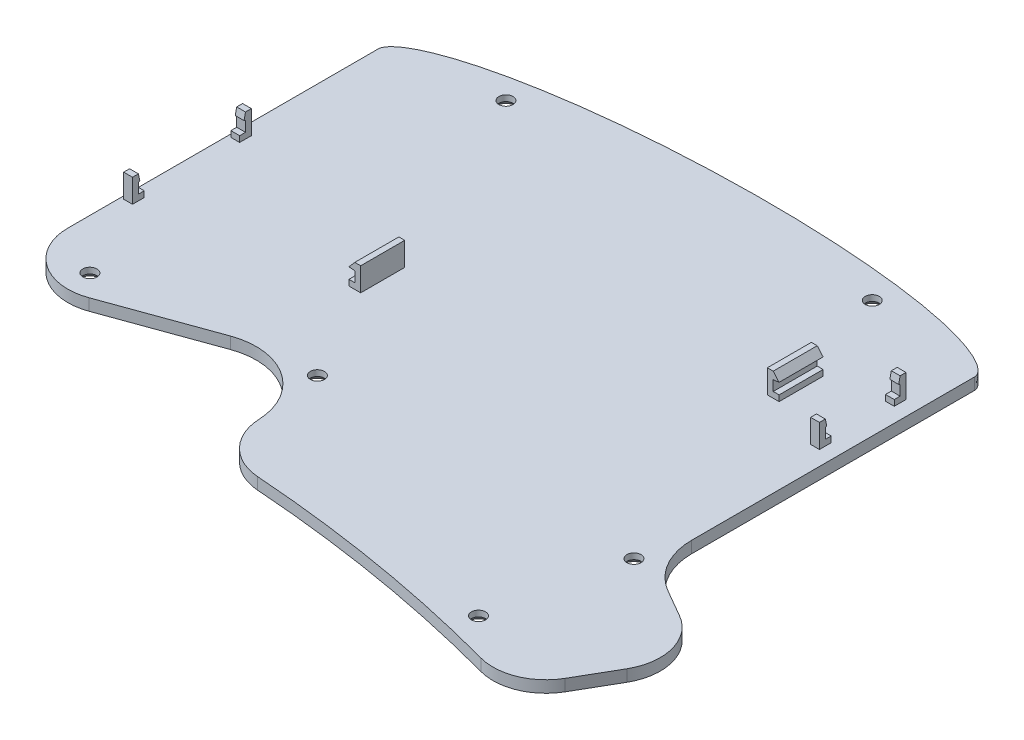
from build123d import *

# Parameters (mm, degrees)
SKETCH1_W                                      = 1
SKETCH1_H                                      = 13
SKETCH1_H_2                                    = 21
BOSS_EXTRUDE1_DEPTH                            = 2
CSK_FOR_M2_FLAT_HEAD_MACHINE_SCREW2_AT_2_COUNT = 2
CSK_FOR_M2_FLAT_HEAD_MACHINE_SCREW2_AT_2_PITCH = 60.71715783
CSK_FOR_M2_FLAT_HEAD_MACHINE_SCREW2_AT_3_COUNT = 2
CSK_FOR_M2_FLAT_HEAD_MACHINE_SCREW2_AT_3_PITCH = 94.415886592
CSK_FOR_M2_FLAT_HEAD_MACHINE_SCREW2_AT_4_COUNT = 2
CSK_FOR_M2_FLAT_HEAD_MACHINE_SCREW2_AT_4_PITCH = 68.646308598
CSK_FOR_M2_FLAT_HEAD_MACHINE_SCREW2_AT_5_COUNT = 2
CSK_FOR_M2_FLAT_HEAD_MACHINE_SCREW2_AT_5_PITCH = 81.128678366
CSK_FOR_M2_FLAT_HEAD_MACHINE_SCREW2_AT_6_COUNT = 2
CSK_FOR_M2_FLAT_HEAD_MACHINE_SCREW2_AT_6_PITCH = 61.04624463
SKETCH8_W                                      = 1.5
SKETCH8_H                                      = 1
SKETCH8_W_2                                    = 1
SKETCH8_H_2                                    = 7.5
BOSS_EXTRUDE2_DEPTH                            = 1
BOSS_EXTRUDE3_START                            = 1
SKETCH8_3_W                                    = 1
SKETCH8_3_H                                    = 7.5
SKETCH8_3_W_2                                  = 1.5
SKETCH8_3_H_2                                  = 1
BOSS_EXTRUDE3_DEPTH                            = 3
BOSS_EXTRUDE4_REACH                            = 140.28
BOSS_EXTRUDE4_DIRECTION_2_REACH                = 140.28
BOSS_EXTRUDE5_REACH                            = 116.126
BOSS_EXTRUDE5_DIRECTION_2_REACH                = 116.126
BOSS_EXTRUDE6_REACH                            = 125.601
BOSS_EXTRUDE6_DIRECTION_2_REACH                = 125.601
BOSS_EXTRUDE7_REACH                            = 127.102
BOSS_EXTRUDE7_DIRECTION_2_REACH                = 127.102


with BuildPart() as part:
    # Sketch1 → Boss-Extrude1 (new body)
    with BuildSketch(Plane(origin=(0, -18, 0), x_dir=(-1, 0, 0), z_dir=(0, -1, 0))):
        with BuildLine():
            Line((3.5375, 21.383174783), (3.5375, 46.51875))
            Line((3.5375, 46.51875), (2.5375, 46.51875))
            Line((2.5375, 46.51875), (2.5375, 21.383174783))
            ThreePointArc((2.5375, 21.383174783), (1.063470667, 15.882640004), (-2.96356961, 11.856277882))
            Line((-2.96356961, 11.856277882), (-7.606020535, 9.176652528))
            ThreePointArc((-7.606020535, 9.176652528), (-11.799966519, 3.712266146), (-10.901629499, -3.117206165))
            Line((-10.901629499, -3.117206165), (-7.061364098, -9.770465972))
            ThreePointArc((-7.061364098, -9.770465972), (-2.702134101, -13.589833364), (3.081788876, -13.959547339))
            ThreePointArc((3.081788876, -13.959547339), (25.794866758, -8.981326054), (48.881783112, -6.213495259))
            ThreePointArc((48.881783112, -6.213495259), (54.690504824, -3.515001844), (57.233571455, 2.36342709))
            ThreePointArc((57.233571455, 2.36342709), (62.105951354, 11.016634667), (71.9636238, 12.218458781))
            Line((71.9636238, 12.218458781), (89.669845612, 5.815157515))
            ThreePointArc((89.669845612, 5.815157515), (97.900386631, 6.911655641), (101.730615166, 14.278708172))
            Line((101.730615166, 14.278708172), (101.730615166, 22.93125))
            Line((101.730615166, 22.93125), (100.730615166, 22.93125))
            Line((100.730615166, 22.93125), (100.730615166, 14.278708172))
            ThreePointArc((100.730615166, 14.278708172), (100.419869855, 12.070685907), (99.511774585, 10.034196784))
            ThreePointArc((99.511774585, 10.034196784), (97.789489945, 9.2290678), (96.349172684, 10.470028415))
            ThreePointArc((96.349172684, 10.470028415), (92.672630426, 12.756839452), (89.986407023, 9.361155204))
            ThreePointArc((89.986407023, 9.361155204), (89.287071474, 7.854887539), (87.644376079, 7.611034457))
            Line((87.644376079, 7.611034457), (72.303709306, 13.158853298))
            ThreePointArc((72.303709306, 13.158853298), (68.259020854, 13.87406407), (64.210075088, 13.183362028))
            ThreePointArc((64.210075088, 13.183362028), (62.767655957, 13.306970242), (61.911902302, 14.474676378))
            ThreePointArc((61.911902302, 14.474676378), (56.707715414, 16.353605132), (57.366621578, 10.859992742))
            ThreePointArc((57.366621578, 10.859992742), (58.311661559, 9.763292521), (58.10732055, 8.330080502))
            ThreePointArc((58.10732055, 8.330080502), (56.781134603, 5.492262939), (56.234561293, 2.407909635))
            ThreePointArc((56.234561293, 2.407909635), (53.974057621, -2.817360528), (48.810749433, -5.216021341))
            ThreePointArc((48.810749433, -5.216021341), (31.764578857, -7.038247949), (14.890028494, -10.061820531))
            ThreePointArc((14.890028494, -10.061820531), (13.366465777, -9.66672828), (12.776518018, -8.207515177))
            ThreePointArc((12.776518018, -8.207515177), (8.78963294, -4.777782449), (6.761066998, -9.629920064))
            ThreePointArc((6.761066998, -9.629920064), (6.88714243, -11.19881975), (5.701883027, -12.234436179))
            ThreePointArc((5.701883027, -12.234436179), (4.260199796, -12.609882906), (2.820853415, -12.994191091))
            ThreePointArc((2.820853415, -12.994191091), (-2.320411453, -12.665556447), (-6.195282561, -9.27056321))
            Line((-6.195282561, -9.27056321), (-10.035547962, -2.617303402))
            ThreePointArc((-10.035547962, -2.617303402), (-10.834069758, 3.453338652), (-7.106117772, 8.310570991))
            Line((-7.106117772, 8.310570991), (-2.463666847, 10.990196345))
            ThreePointArc((-2.463666847, 10.990196345), (-1.495506776, 11.61275998), (-0.591448819, 12.325219533))
            ThreePointArc((-0.591448819, 12.325219533), (0.796234375, 12.73775716), (2.019793328, 11.963964275))
            ThreePointArc((2.019793328, 11.963964275), (7.550614754, 12.118718195), (4.928015057, 16.990669062))
            ThreePointArc((4.928015057, 16.990669062), (3.647327745, 17.665718652), (3.31329644, 19.074361625))
            ThreePointArc((3.31329644, 19.074361625), (3.481317591, 20.223338002), (3.5375, 21.383174783))
        make_face()
        with BuildLine():
            Line((3.5375, 59.51875), (3.5375, 46.51875))
            Line((3.5375, 46.51875), (3.5375, 21.383174783))
            ThreePointArc((3.5375, 21.383174783), (3.481317591, 20.223338002), (3.31329644, 19.074361625))
            ThreePointArc((3.31329644, 19.074361625), (3.647327745, 17.665718652), (4.928015057, 16.990669062))
            ThreePointArc((4.928015057, 16.990669062), (7.550614754, 12.118718195), (2.019793328, 11.963964275))
            ThreePointArc((2.019793328, 11.963964275), (0.796234375, 12.73775716), (-0.591448819, 12.325219533))
            ThreePointArc((-0.591448819, 12.325219533), (-1.495506776, 11.61275998), (-2.463666847, 10.990196345))
            Line((-2.463666847, 10.990196345), (-7.106117772, 8.310570991))
            ThreePointArc((-7.106117772, 8.310570991), (-10.834069758, 3.453338652), (-10.035547962, -2.617303402))
            Line((-10.035547962, -2.617303402), (-6.195282561, -9.27056321))
            ThreePointArc((-6.195282561, -9.27056321), (-2.320411453, -12.665556447), (2.820853415, -12.994191091))
            ThreePointArc((2.820853415, -12.994191091), (4.260199796, -12.609882906), (5.701883027, -12.234436179))
            ThreePointArc((5.701883027, -12.234436179), (6.88714243, -11.19881975), (6.761066998, -9.629920064))
            ThreePointArc((6.761066998, -9.629920064), (8.78963294, -4.777782449), (12.776518018, -8.207515177))
            ThreePointArc((12.776518018, -8.207515177), (13.366465777, -9.66672828), (14.890028494, -10.061820531))
            ThreePointArc((14.890028494, -10.061820531), (31.764578857, -7.038247949), (48.810749433, -5.216021341))
            ThreePointArc((48.810749433, -5.216021341), (53.974057621, -2.817360528), (56.234561293, 2.407909635))
            ThreePointArc((56.234561293, 2.407909635), (56.781134603, 5.492262939), (58.10732055, 8.330080502))
            ThreePointArc((58.10732055, 8.330080502), (58.311661559, 9.763292521), (57.366621578, 10.859992742))
            ThreePointArc((57.366621578, 10.859992742), (56.707715414, 16.353605132), (61.911902302, 14.474676378))
            ThreePointArc((61.911902302, 14.474676378), (62.767655957, 13.306970242), (64.210075088, 13.183362028))
            ThreePointArc((64.210075088, 13.183362028), (68.259020854, 13.87406407), (72.303709306, 13.158853298))
            Line((72.303709306, 13.158853298), (87.644376079, 7.611034457))
            ThreePointArc((87.644376079, 7.611034457), (89.287071474, 7.854887539), (89.986407023, 9.361155204))
            ThreePointArc((89.986407023, 9.361155204), (92.672630426, 12.756839452), (96.349172684, 10.470028415))
            ThreePointArc((96.349172684, 10.470028415), (97.789489945, 9.2290678), (99.511774585, 10.034196784))
            ThreePointArc((99.511774585, 10.034196784), (100.419869855, 12.070685907), (100.730615166, 14.278708172))
            Line((100.730615166, 14.278708172), (100.730615166, 22.93125))
            Line((100.730615166, 22.93125), (100.730615166, 43.93125))
            Line((100.730615166, 43.93125), (100.730615166, 67.164634727))
            add(Edge.make_bspline(
                [(88.620104248, 72.598317081), (88.929301473, 72.523560812), (89.238079904, 72.447060307), (90.562566461, 72.110499889), (91.57329427, 71.832096728), (93.57938348, 71.218232259), (94.573305027, 70.883949605), (96.040749334, 70.31553203), (96.525188662, 70.115027036), (97.480793406, 69.682916814), (97.952079847, 69.451604933), (98.868980609, 68.942188708), (99.31665083, 68.665028512), (99.939326788, 68.184144678), (100.139184116, 68.012869641), (100.410015865, 67.727114834), (100.495516055, 67.627114913), (100.608228775, 67.465419655), (100.643137924, 67.409749415), (100.687729415, 67.321804673), (100.701248617, 67.291904033), (100.723269859, 67.229917254), (100.73418758, 67.197643884), (100.730615166, 67.164634727)],
                knots=[0.865518224, 0.865518224, 0.865518224, 0.865518224, 0.875, 0.875, 0.90625, 0.90625, 0.9375, 0.9375, 0.953125, 0.953125, 0.96875, 0.96875, 0.984375, 0.984375, 0.9921875, 0.9921875, 0.99609375, 0.99609375, 0.998046875, 0.998046875, 0.999023438, 0.999023438, 1, 1, 1, 1], degree=3))
            ThreePointArc((88.620104248, 72.598317081), (87.063552302, 72.220505208), (86.466465706, 70.734206662))
            ThreePointArc((86.466465706, 70.734206662), (82.615217481, 67.240064482), (80.339453892, 71.9157508))
            ThreePointArc((80.339453892, 71.9157508), (80.341311658, 73.510795049), (79.048332963, 74.444805595))
            add(Edge.make_bspline(
                [(26.948050585, 75.898504354), (27.111227376, 75.913938633), (27.274398145, 75.929121002), (31.596167021, 76.324738014), (35.751054647, 76.549982719), (44.055510634, 76.777995247), (52.354550241, 76.779469056), (60.643745607, 76.369209951), (68.927521195, 75.732270067), (73.066747928, 75.302501914), (77.817537532, 74.629953207), (78.432988847, 74.539313014), (79.048332963, 74.444805595)],
                knots=[0.245095563, 0.245095563, 0.245095563, 0.245095563, 0.25, 0.25, 0.375, 0.375, 0.5, 0.625, 0.625, 0.75, 0.75, 0.76859764, 0.76859764, 0.76859764, 0.76859764], degree=3))
            ThreePointArc((26.948050585, 75.898504354), (25.603535559, 75.041998878), (25.51147164, 73.450506961))
            ThreePointArc((25.51147164, 73.450506961), (22.957426833, 68.917027953), (19.326954928, 72.644661323))
            ThreePointArc((19.326954928, 72.644661323), (18.825675188, 74.163836813), (17.298656749, 74.64069133))
            add(Edge.make_bspline(
                [(3.5375, 69.572252231), (3.541173709, 69.606197357), (3.554301601, 69.637518494), (3.581974976, 69.69884299), (3.59790109, 69.728184635), (3.649208348, 69.813979148), (3.688170843, 69.868168455), (3.813161744, 70.025614685), (3.90522549, 70.121181493), (4.194279123, 70.393030468), (4.405585706, 70.554931133), (5.061372746, 71.006569742), (5.522514638, 71.25902), (6.466097746, 71.720662819), (6.949517754, 71.92786751), (7.931027893, 72.312482719), (8.428830807, 72.489345777), (9.926006799, 72.983364256), (10.934004841, 73.266597108), (12.96190189, 73.777521594), (13.981961729, 74.004462636), (15.768195991, 74.364895691), (16.532403117, 74.507568977), (17.298656749, 74.64069133)],
                knots=[0, 0, 0, 0, 0.000976562, 0.000976562, 0.001953125, 0.001953125, 0.00390625, 0.00390625, 0.0078125, 0.0078125, 0.015625, 0.015625, 0.03125, 0.03125, 0.046875, 0.046875, 0.0625, 0.0625, 0.09375, 0.09375, 0.125, 0.125, 0.148240494, 0.148240494, 0.148240494, 0.148240494], degree=3))
            Line((3.5375, 69.572252231), (3.5375, 59.51875))
        make_face()
        with Locations((3.0375, 53.01875)):
            Rectangle(SKETCH1_W, SKETCH1_H)
        with BuildLine():
            Line((2.5375, 59.51875), (3.5375, 59.51875))
            Line((3.5375, 59.51875), (3.5375, 69.572252231))
            add(Edge.make_bspline(
                [(3.5375, 69.572252231), (3.541173709, 69.606197357), (3.554301601, 69.637518494), (3.581974976, 69.69884299), (3.59790109, 69.728184635), (3.649208348, 69.813979148), (3.688170843, 69.868168455), (3.813161744, 70.025614685), (3.90522549, 70.121181493), (4.194279123, 70.393030468), (4.405585706, 70.554931133), (5.061372746, 71.006569742), (5.522514638, 71.25902), (6.466097746, 71.720662819), (6.949517754, 71.92786751), (7.931027893, 72.312482719), (8.428830807, 72.489345777), (9.926006799, 72.983364256), (10.934004841, 73.266597108), (12.96190189, 73.777521594), (13.981961729, 74.004462636), (15.768195991, 74.364895691), (16.532403117, 74.507568977), (17.298656749, 74.64069133)],
                knots=[0, 0, 0, 0, 0.000976562, 0.000976562, 0.001953125, 0.001953125, 0.00390625, 0.00390625, 0.0078125, 0.0078125, 0.015625, 0.015625, 0.03125, 0.03125, 0.046875, 0.046875, 0.0625, 0.0625, 0.09375, 0.09375, 0.125, 0.125, 0.148240494, 0.148240494, 0.148240494, 0.148240494], degree=3))
            ThreePointArc((17.298656749, 74.64069133), (18.825675188, 74.163836813), (19.326954928, 72.644661323))
            ThreePointArc((19.326954928, 72.644661323), (22.957426833, 68.917027953), (25.51147164, 73.450506961))
            ThreePointArc((25.51147164, 73.450506961), (25.603535559, 75.041998878), (26.948050585, 75.898504354))
            add(Edge.make_bspline(
                [(26.948050585, 75.898504354), (27.111227376, 75.913938633), (27.274398145, 75.929121002), (31.596167021, 76.324738014), (35.751054647, 76.549982719), (44.055510634, 76.777995247), (52.354550241, 76.779469056), (60.643745607, 76.369209951), (68.927521195, 75.732270067), (73.066747928, 75.302501914), (77.817537532, 74.629953207), (78.432988847, 74.539313014), (79.048332963, 74.444805595)],
                knots=[0.245095563, 0.245095563, 0.245095563, 0.245095563, 0.25, 0.25, 0.375, 0.375, 0.5, 0.625, 0.625, 0.75, 0.75, 0.76859764, 0.76859764, 0.76859764, 0.76859764], degree=3))
            ThreePointArc((79.048332963, 74.444805595), (80.341311658, 73.510795049), (80.339453892, 71.9157508))
            ThreePointArc((80.339453892, 71.9157508), (82.615217481, 67.240064482), (86.466465706, 70.734206662))
            ThreePointArc((86.466465706, 70.734206662), (87.063552302, 72.220505208), (88.620104248, 72.598317081))
            add(Edge.make_bspline(
                [(88.620104248, 72.598317081), (88.929301473, 72.523560812), (89.238079904, 72.447060307), (90.562566461, 72.110499889), (91.57329427, 71.832096728), (93.57938348, 71.218232259), (94.573305027, 70.883949605), (96.040749334, 70.31553203), (96.525188662, 70.115027036), (97.480793406, 69.682916814), (97.952079847, 69.451604933), (98.868980609, 68.942188708), (99.31665083, 68.665028512), (99.939326788, 68.184144678), (100.139184116, 68.012869641), (100.410015865, 67.727114834), (100.495516055, 67.627114913), (100.608228775, 67.465419655), (100.643137924, 67.409749415), (100.687729415, 67.321804673), (100.701248617, 67.291904033), (100.723269859, 67.229917254), (100.73418758, 67.197643884), (100.730615166, 67.164634727)],
                knots=[0.865518224, 0.865518224, 0.865518224, 0.865518224, 0.875, 0.875, 0.90625, 0.90625, 0.9375, 0.9375, 0.953125, 0.953125, 0.96875, 0.96875, 0.984375, 0.984375, 0.9921875, 0.9921875, 0.99609375, 0.99609375, 0.998046875, 0.998046875, 0.999023438, 0.999023438, 1, 1, 1, 1], degree=3))
            Line((100.730615166, 67.164634727), (100.730615166, 43.93125))
            Line((100.730615166, 43.93125), (101.730615166, 43.93125))
            Line((101.730615166, 43.93125), (101.730615166, 67.138668169))
            add(Edge.make_bspline(
                [(101.730615166, 67.138668169), (101.735250856, 67.275115571), (101.713390966, 67.410853841), (101.633067165, 67.668568345), (101.575943762, 67.790415694), (101.372266606, 68.142605821), (101.199050454, 68.35209953), (100.823600333, 68.73987033), (100.621626657, 68.91640552), (100.200752158, 69.248864107), (99.981555205, 69.4045279), (99.306020246, 69.849053581), (98.836934468, 70.112892412), (97.877227791, 70.60318759), (97.388248328, 70.828061244), (95.903014167, 71.461712841), (94.889908109, 71.8297132), (92.84420924, 72.500797549), (91.810189071, 72.803249694), (88.691987496, 73.64074601), (86.588446512, 74.108153002), (82.363129011, 74.930812273), (80.23840048, 75.28499058), (73.849740033, 76.220505361), (69.565842948, 76.677808339), (60.985265325, 77.35347005), (56.684044098, 77.570000099), (48.079283608, 77.782221024), (43.778248843, 77.778001783), (37.328917876, 77.5895358), (35.179515146, 77.496024517), (30.881566022, 77.238782186), (28.735526018, 77.075301003), (24.458229251, 76.663778997), (22.325886522, 76.416107346), (18.078385438, 75.806547795), (15.962972556, 75.446351614), (12.810643947, 74.767871486), (11.76337701, 74.518387043), (9.679226408, 73.950405555), (8.640851682, 73.63218254), (7.121659224, 73.074949932), (6.620981384, 72.875527364), (5.636459764, 72.436424079), (5.152330354, 72.197426437), (4.447748092, 71.787245869), (4.215675375, 71.641076345), (3.770440702, 71.328087125), (3.556445051, 71.161234247), (3.256558964, 70.885596087), (3.160158936, 70.789437239), (2.977470232, 70.584971563), (2.891265175, 70.476633482), (2.663759238, 70.135173542), (2.546954708, 69.876509698), (2.5375, 69.598218788)],
                knots=[0, 0, 0, 0, 0.00390625, 0.00390625, 0.0078125, 0.0078125, 0.015625, 0.015625, 0.0234375, 0.0234375, 0.03125, 0.03125, 0.046875, 0.046875, 0.0625, 0.0625, 0.09375, 0.09375, 0.125, 0.125, 0.1875, 0.1875, 0.25, 0.25, 0.375, 0.375, 0.5, 0.5, 0.625, 0.625, 0.6875, 0.6875, 0.75, 0.75, 0.8125, 0.8125, 0.875, 0.875, 0.90625, 0.90625, 0.9375, 0.9375, 0.953125, 0.953125, 0.96875, 0.96875, 0.9765625, 0.9765625, 0.984375, 0.984375, 0.98828125, 0.98828125, 0.9921875, 0.9921875, 1, 1, 1, 1], degree=3))
            Line((2.5375, 69.598218788), (2.5375, 59.51875))
        make_face()
        with Locations((101.230615166, 33.43125)):
            Rectangle(SKETCH1_W, SKETCH1_H_2)
    extrude(amount=BOSS_EXTRUDE1_DEPTH)

    # Sketch7 → CSK for M2 Flat Head Machine Screw2 (revolve, cut)
    with BuildSketch(Plane(origin=(-22.5375, -20, -72.139784762), x_dir=(0, 0, -1), z_dir=(1, 0, 0))):
        Polygon((0, 0), (0, 2), (1.2, 2), (1.2, 1), (2.2, 0), align=None)
    csk_for_m2_flat_head_machine_screw2 = revolve(axis=Axis((-22.5375, -26.35, -72.139784762), (0, 1, 0)), mode=Mode.SUBTRACT)

    # CSK for M2 Flat Head Machine Screw2 at 2: CSK for M2 Flat Head Machine Screw2 ×2
    with Locations(*[Vector(-0.9996040219096323, 0, 0.02813893000964052) * (i * CSK_FOR_M2_FLAT_HEAD_MACHINE_SCREW2_AT_2_PITCH) for i in range(1, CSK_FOR_M2_FLAT_HEAD_MACHINE_SCREW2_AT_2_COUNT)]):
        add(csk_for_m2_flat_head_machine_screw2, mode=Mode.SUBTRACT)

    # CSK for M2 Flat Head Machine Screw2 at 3: CSK for M2 Flat Head Machine Screw2 ×2
    with Locations(*[Vector(-0.7487417395271838, 0, 0.6628618313719737) * (i * CSK_FOR_M2_FLAT_HEAD_MACHINE_SCREW2_AT_3_PITCH) for i in range(1, CSK_FOR_M2_FLAT_HEAD_MACHINE_SCREW2_AT_3_COUNT)]):
        add(csk_for_m2_flat_head_machine_screw2, mode=Mode.SUBTRACT)

    # CSK for M2 Flat Head Machine Screw2 at 4: CSK for M2 Flat Head Machine Screw2 ×2
    with Locations(*[Vector(-0.5272405159888823, 0, 0.8497160927626222) * (i * CSK_FOR_M2_FLAT_HEAD_MACHINE_SCREW2_AT_4_PITCH) for i in range(1, CSK_FOR_M2_FLAT_HEAD_MACHINE_SCREW2_AT_4_COUNT)]):
        add(csk_for_m2_flat_head_machine_screw2, mode=Mode.SUBTRACT)

    # CSK for M2 Flat Head Machine Screw2 at 5: CSK for M2 Flat Head Machine Screw2 ×2
    with Locations(*[Vector(0.16023926756585227, 0, 0.987078202134947) * (i * CSK_FOR_M2_FLAT_HEAD_MACHINE_SCREW2_AT_5_PITCH) for i in range(1, CSK_FOR_M2_FLAT_HEAD_MACHINE_SCREW2_AT_5_COUNT)]):
        add(csk_for_m2_flat_head_machine_screw2, mode=Mode.SUBTRACT)

    # CSK for M2 Flat Head Machine Screw2 at 6: CSK for M2 Flat Head Machine Screw2 ×2
    with Locations(*[Vector(0.2915822276671845, 0, 0.9565457670747607) * (i * CSK_FOR_M2_FLAT_HEAD_MACHINE_SCREW2_AT_6_PITCH) for i in range(1, CSK_FOR_M2_FLAT_HEAD_MACHINE_SCREW2_AT_6_COUNT)]):
        add(csk_for_m2_flat_head_machine_screw2, mode=Mode.SUBTRACT)

    # Sketch8 → Boss-Extrude2 (add)
    with BuildSketch(Plane(origin=(0, -18, 0), x_dir=(1, 0, 0), z_dir=(0, 1, 0))):
        with Locations((-5.7875, 47.14375)):
            Rectangle(SKETCH8_W, SKETCH8_H)
        with Locations((-5.7875, 58.89375)):
            Rectangle(SKETCH8_W, SKETCH8_H)
        with Locations((-5.7875, 59.89375)):
            Rectangle(SKETCH8_W, SKETCH8_H)
        with Locations((-16.0375, 53.01875)):
            Rectangle(SKETCH8_W_2, SKETCH8_H_2)
        with Locations((-17.0375, 53.01875)):
            Rectangle(SKETCH8_W_2, SKETCH8_H_2)
        with Locations((-5.7875, 46.14375)):
            Rectangle(SKETCH8_W, SKETCH8_H)
        with Locations((-68.730615166, 33.43125)):
            Rectangle(SKETCH8_W_2, SKETCH8_H_2)
        with Locations((-67.730615166, 33.43125)):
            Rectangle(SKETCH8_W_2, SKETCH8_H_2)
        with Locations((-100.480615166, 23.80625)):
            Rectangle(SKETCH8_W, SKETCH8_H)
        with Locations((-100.480615166, 24.80625)):
            Rectangle(SKETCH8_W, SKETCH8_H)
        with Locations((-100.480615166, 42.05625)):
            Rectangle(SKETCH8_W, SKETCH8_H)
        with Locations((-100.480615166, 43.05625)):
            Rectangle(SKETCH8_W, SKETCH8_H)
    extrude(amount=BOSS_EXTRUDE2_DEPTH)

    # Sketch8<3> → Boss-Extrude3 (add)
    with BuildSketch(Plane(origin=(0, -18, 0), x_dir=(1, 0, 0), z_dir=(0, 1, 0)).offset(BOSS_EXTRUDE3_START)):
        with Locations((-17.0375, 53.01875)):
            Rectangle(SKETCH8_3_W, SKETCH8_3_H)
        with Locations((-5.7875, 46.14375)):
            Rectangle(SKETCH8_3_W_2, SKETCH8_3_H_2)
        with Locations((-5.7875, 59.89375)):
            Rectangle(SKETCH8_3_W_2, SKETCH8_3_H_2)
        with Locations((-67.730615166, 33.43125)):
            Rectangle(SKETCH8_3_W, SKETCH8_3_H)
        with Locations((-100.480615166, 23.80625)):
            Rectangle(SKETCH8_3_W_2, SKETCH8_3_H_2)
        with Locations((-100.480615166, 43.05625)):
            Rectangle(SKETCH8_3_W_2, SKETCH8_3_H_2)
    extrude(amount=BOSS_EXTRUDE3_DEPTH)

    # Boss-Extrude4: up to this face of the body (flat: up to its plane)
    boss_extrude4_end = Plane(part.part.faces().sort_by_distance((-101.230615166, -16.3, -42.85625))[0])
    # Sketch12 → Boss-Extrude4 (add, up to the picked face)
    with BuildSketch(Plane.ZY.offset(100.480615166), mode=Mode.PRIVATE) as boss_extrude4_sk1:
        Polygon((-24.55625, -15.15), (-24.30625, -15.25), (-24.30625, -14), align=None)
    boss_extrude4_tool1 = split(extrude(boss_extrude4_sk1.sketch, amount=BOSS_EXTRUDE4_REACH, mode=Mode.PRIVATE), bisect_by=boss_extrude4_end, keep=Keep.BOTH, mode=Mode.PRIVATE)
    # Sketch12 → Boss-Extrude4 (add, up to the picked face)
    with BuildSketch(Plane.ZY.offset(100.480615166), mode=Mode.PRIVATE) as boss_extrude4_sk2:
        Polygon((-42.30625, -15.15), (-42.55625, -15.25), (-42.55625, -14), align=None)
    boss_extrude4_tool2 = split(extrude(boss_extrude4_sk2.sketch, amount=BOSS_EXTRUDE4_REACH, mode=Mode.PRIVATE), bisect_by=boss_extrude4_end, keep=Keep.BOTH, mode=Mode.PRIVATE)
    add(boss_extrude4_tool1.solids().sort_by(Axis((-100.480615, -14.8, -24.389583), (-1, 0, 0)))[0])
    add(boss_extrude4_tool2.solids().sort_by(Axis((-100.480615, -14.8, -42.472917), (-1, 0, 0)))[0])

    # Boss-Extrude4 direction 2: up to this face of the body (flat: up to its plane)
    boss_extrude4_direction_2_end = Plane(part.part.faces().sort_by_distance((-99.730615166, -16.3, -42.85625))[0])
    # Sketch12 → Boss-Extrude4 direction 2 (add, up to the picked face)
    with BuildSketch(Plane.ZY.offset(100.480615166), mode=Mode.PRIVATE) as boss_extrude4_direction_2_sk1:
        Polygon((-24.55625, -15.15), (-24.30625, -15.25), (-24.30625, -14), align=None)
    boss_extrude4_direction_2_tool1 = split(extrude(boss_extrude4_direction_2_sk1.sketch, amount=-BOSS_EXTRUDE4_DIRECTION_2_REACH, mode=Mode.PRIVATE), bisect_by=boss_extrude4_direction_2_end, keep=Keep.BOTH, mode=Mode.PRIVATE)
    # Sketch12 → Boss-Extrude4 direction 2 (add, up to the picked face)
    with BuildSketch(Plane.ZY.offset(100.480615166), mode=Mode.PRIVATE) as boss_extrude4_direction_2_sk2:
        Polygon((-42.30625, -15.15), (-42.55625, -15.25), (-42.55625, -14), align=None)
    boss_extrude4_direction_2_tool2 = split(extrude(boss_extrude4_direction_2_sk2.sketch, amount=-BOSS_EXTRUDE4_DIRECTION_2_REACH, mode=Mode.PRIVATE), bisect_by=boss_extrude4_direction_2_end, keep=Keep.BOTH, mode=Mode.PRIVATE)
    add(boss_extrude4_direction_2_tool1.solids().sort_by(Axis((-100.480615, -14.8, -24.389583), (1, 0, 0)))[0])
    add(boss_extrude4_direction_2_tool2.solids().sort_by(Axis((-100.480615, -14.8, -42.472917), (1, 0, 0)))[0])

    # Boss-Extrude5: up to this face of the body (flat: up to its plane)
    boss_extrude5_end = Plane(part.part.faces().sort_by_distance((-67.930615166, -16.3, -37.18125))[0])
    # Sketch11 → Boss-Extrude5 (add, up to the picked face)
    with BuildSketch(Plane(origin=(0, 0, -33.43125), x_dir=(-1, 0, 0), z_dir=(0, 0, -1)), mode=Mode.PRIVATE) as boss_extrude5_sk1:
        Polygon((69.230615166, -15.15), (68.230615166, -15.25), (68.230615166, -14), align=None)
    boss_extrude5_tool1 = split(extrude(boss_extrude5_sk1.sketch, amount=BOSS_EXTRUDE5_REACH, mode=Mode.PRIVATE), bisect_by=boss_extrude5_end, keep=Keep.BOTH, mode=Mode.PRIVATE)
    add(boss_extrude5_tool1.solids().sort_by(Axis((-68.563948, -14.8, -33.43125), (0, 0, -1)))[0])

    # Boss-Extrude5 direction 2: up to this face of the body (flat: up to its plane)
    boss_extrude5_direction_2_end = Plane(part.part.faces().sort_by_distance((-67.930615166, -16.3, -29.68125))[0])
    # Sketch11 → Boss-Extrude5 direction 2 (add, up to the picked face)
    with BuildSketch(Plane(origin=(0, 0, -33.43125), x_dir=(-1, 0, 0), z_dir=(0, 0, -1)), mode=Mode.PRIVATE) as boss_extrude5_direction_2_sk1:
        Polygon((69.230615166, -15.15), (68.230615166, -15.25), (68.230615166, -14), align=None)
    boss_extrude5_direction_2_tool1 = split(extrude(boss_extrude5_direction_2_sk1.sketch, amount=-BOSS_EXTRUDE5_DIRECTION_2_REACH, mode=Mode.PRIVATE), bisect_by=boss_extrude5_direction_2_end, keep=Keep.BOTH, mode=Mode.PRIVATE)
    add(boss_extrude5_direction_2_tool1.solids().sort_by(Axis((-68.563948, -14.8, -33.43125), (0, 0, 1)))[0])

    # Boss-Extrude6: up to this face of the body (flat: up to its plane)
    boss_extrude6_end = Plane(part.part.faces().sort_by_distance((-16.8375, -16.3, -56.76875))[0])
    # Sketch10 → Boss-Extrude6 (add, up to the picked face)
    with BuildSketch(Plane(origin=(0, 0, -53.01875), x_dir=(-1, 0, 0), z_dir=(0, 0, -1)), mode=Mode.PRIVATE) as boss_extrude6_sk1:
        Polygon((16.5375, -15.25), (16.5375, -14), (15.5375, -15.15), align=None)
    boss_extrude6_tool1 = split(extrude(boss_extrude6_sk1.sketch, amount=BOSS_EXTRUDE6_REACH, mode=Mode.PRIVATE), bisect_by=boss_extrude6_end, keep=Keep.BOTH, mode=Mode.PRIVATE)
    add(boss_extrude6_tool1.solids().sort_by(Axis((-16.204167, -14.8, -53.01875), (0, 0, -1)))[0])

    # Boss-Extrude6 direction 2: up to this face of the body (flat: up to its plane)
    boss_extrude6_direction_2_end = Plane(part.part.faces().sort_by_distance((-16.8375, -16.3, -49.26875))[0])
    # Sketch10 → Boss-Extrude6 direction 2 (add, up to the picked face)
    with BuildSketch(Plane(origin=(0, 0, -53.01875), x_dir=(-1, 0, 0), z_dir=(0, 0, -1)), mode=Mode.PRIVATE) as boss_extrude6_direction_2_sk1:
        Polygon((16.5375, -15.25), (16.5375, -14), (15.5375, -15.15), align=None)
    boss_extrude6_direction_2_tool1 = split(extrude(boss_extrude6_direction_2_sk1.sketch, amount=-BOSS_EXTRUDE6_DIRECTION_2_REACH, mode=Mode.PRIVATE), bisect_by=boss_extrude6_direction_2_end, keep=Keep.BOTH, mode=Mode.PRIVATE)
    add(boss_extrude6_direction_2_tool1.solids().sort_by(Axis((-16.204167, -14.8, -53.01875), (0, 0, 1)))[0])

    # Boss-Extrude7: up to this face of the body (flat: up to its plane)
    boss_extrude7_end = Plane(part.part.faces().sort_by_distance((-5.0375, -16.3, -46.34375))[0])
    # Sketch9 → Boss-Extrude7 (add, up to the picked face)
    with BuildSketch(Plane(origin=(-5.7875, 0, 0), x_dir=(0, 0, -1), z_dir=(1, 0, 0)), mode=Mode.PRIVATE) as boss_extrude7_sk1:
        Polygon((46.89375, -15.15), (46.64375, -15.25), (46.64375, -14), align=None)
    boss_extrude7_tool1 = split(extrude(boss_extrude7_sk1.sketch, amount=BOSS_EXTRUDE7_REACH, mode=Mode.PRIVATE), bisect_by=boss_extrude7_end, keep=Keep.BOTH, mode=Mode.PRIVATE)
    # Sketch9 → Boss-Extrude7 (add, up to the picked face)
    with BuildSketch(Plane(origin=(-5.7875, 0, 0), x_dir=(0, 0, -1), z_dir=(1, 0, 0)), mode=Mode.PRIVATE) as boss_extrude7_sk2:
        Polygon((59.39375, -14), (59.39375, -15.25), (59.14375, -15.15), align=None)
    boss_extrude7_tool2 = split(extrude(boss_extrude7_sk2.sketch, amount=BOSS_EXTRUDE7_REACH, mode=Mode.PRIVATE), bisect_by=boss_extrude7_end, keep=Keep.BOTH, mode=Mode.PRIVATE)
    add(boss_extrude7_tool1.solids().sort_by(Axis((-5.7875, -14.8, -46.727083), (1, 0, 0)))[0])
    add(boss_extrude7_tool2.solids().sort_by(Axis((-5.7875, -14.8, -59.310417), (1, 0, 0)))[0])

    # Boss-Extrude7 direction 2: up to this face of the body (flat: up to its plane)
    boss_extrude7_direction_2_end = Plane(part.part.faces().sort_by_distance((-6.5375, -16.3, -46.34375))[0])
    # Sketch9 → Boss-Extrude7 direction 2 (add, up to the picked face)
    with BuildSketch(Plane(origin=(-5.7875, 0, 0), x_dir=(0, 0, -1), z_dir=(1, 0, 0)), mode=Mode.PRIVATE) as boss_extrude7_direction_2_sk1:
        Polygon((46.89375, -15.15), (46.64375, -15.25), (46.64375, -14), align=None)
    boss_extrude7_direction_2_tool1 = split(extrude(boss_extrude7_direction_2_sk1.sketch, amount=-BOSS_EXTRUDE7_DIRECTION_2_REACH, mode=Mode.PRIVATE), bisect_by=boss_extrude7_direction_2_end, keep=Keep.BOTH, mode=Mode.PRIVATE)
    # Sketch9 → Boss-Extrude7 direction 2 (add, up to the picked face)
    with BuildSketch(Plane(origin=(-5.7875, 0, 0), x_dir=(0, 0, -1), z_dir=(1, 0, 0)), mode=Mode.PRIVATE) as boss_extrude7_direction_2_sk2:
        Polygon((59.39375, -14), (59.39375, -15.25), (59.14375, -15.15), align=None)
    boss_extrude7_direction_2_tool2 = split(extrude(boss_extrude7_direction_2_sk2.sketch, amount=-BOSS_EXTRUDE7_DIRECTION_2_REACH, mode=Mode.PRIVATE), bisect_by=boss_extrude7_direction_2_end, keep=Keep.BOTH, mode=Mode.PRIVATE)
    add(boss_extrude7_direction_2_tool1.solids().sort_by(Axis((-5.7875, -14.8, -46.727083), (-1, 0, 0)))[0])
    add(boss_extrude7_direction_2_tool2.solids().sort_by(Axis((-5.7875, -14.8, -59.310417), (-1, 0, 0)))[0])


solid = part.part
